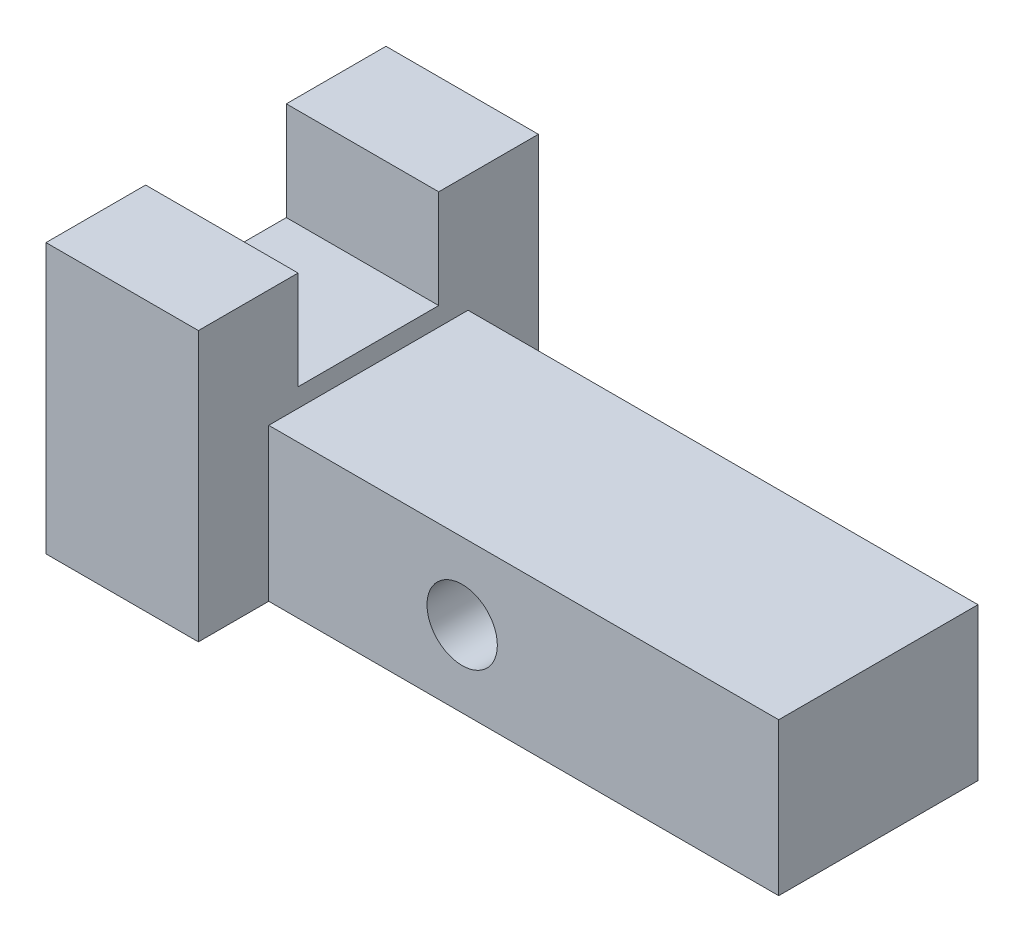
from build123d import *

# Parameters (mm, degrees)
EXTRUDE_1_DEPTH = 26
SKETCH_2_W      = 87
SKETCH_2_H      = 26
SKETCH_2_R      = 6
EXTRUDE_2_DEPTH = 17


with BuildPart() as part:
    # 스케치1 → 보스-돌출1 (new body)
    with BuildSketch(Plane(origin=(0, 0, 0), x_dir=(0, 0, -1), z_dir=(1, 0, 0))):
        Polygon((-29, 0), (29, 0), (29, 46), (12, 46), (12, 29.19214502), (-12, 29.19214502), (-12, 46), (-29, 46), align=None)
    extrude(amount=EXTRUDE_1_DEPTH)

    # 스케치2 → 보스-돌출2 (add, symmetric)
    with BuildSketch(Plane.XY):
        with Locations((69.5, 13)):
            Rectangle(SKETCH_2_W, SKETCH_2_H)
        with Locations((59, 13)):
            Circle(SKETCH_2_R, mode=Mode.SUBTRACT)
    extrude(amount=EXTRUDE_2_DEPTH, both=True)


solid = part.part
